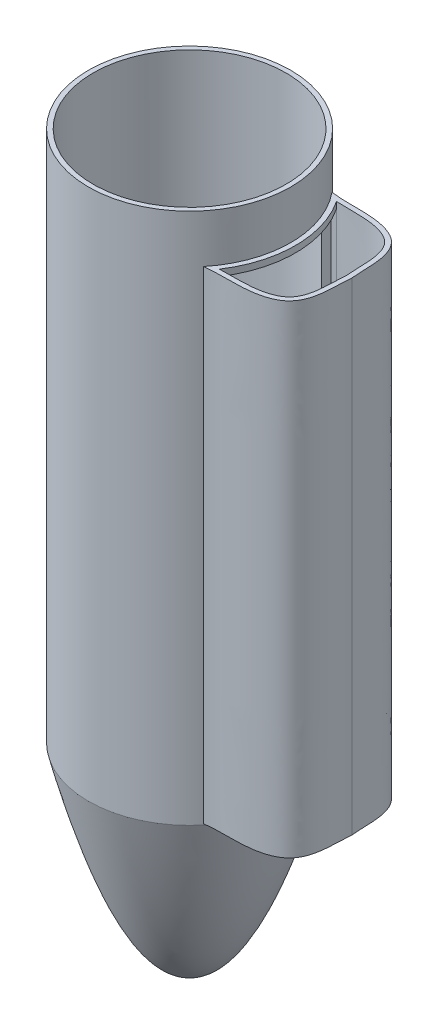
from build123d import *

# Parameters (mm, degrees)
SKETCH_2_R          = 62.908407842
SKETCH_2_R_2        = 60
EXTRUDE_1_DEPTH     = 330
EXTRUDE_START       = 120
EXTRUDE_4_DEPTH     = 300
CUT_EXTRUDE_START   = -30
SKETCH_5_W          = 72
SKETCH_5_H          = 292
CUT_EXTRUDE_2_DEPTH = 18


with BuildPart() as part:
    # Эскиз1 → Повернуть1 (revolve)
    with BuildSketch(Plane.XY, mode=Mode.PRIVATE) as revolve_1_sk:
        with BuildLine():
            Line((60, 120), (62.908407842, 120))
            Line((62.908407842, 120), (62.908407842, 119.264361621))
            add(Edge.make_bspline(
                [(0.146537412, -2.996418994), (0.529065696, -2.977711762), (1.265697509, -2.941722703), (2.538817889, -2.833687069), (3.88739557, -2.604163783), (5.15218658, -2.277601106), (6.357304228, -1.883204814), (7.918990528, -1.273586831), (10.544218169, 0.016383007), (13.874338698, 2.31847492), (18.511365407, 6.56400966), (23.322345732, 12.50099289), (28.167408216, 20.073460146), (32.393246289, 27.908446177), (36.178661594, 35.907467812), (39.632056812, 44.020672418), (43.888107126, 54.948760162), (48.683919334, 68.763712386), (53.85313556, 85.500373253), (57.789846115, 99.528158313), (60.771075111, 110.808987883), (62.195111597, 116.444285272), (62.908407842, 119.264361621)],
                knots=[0, 0, 0, 0, 0.0078125, 0.015625, 0.0234375, 0.03125, 0.0390625, 0.046875, 0.0625, 0.09375, 0.125, 0.1875, 0.25, 0.3125, 0.375, 0.4375, 0.5, 0.625, 0.75, 0.875, 0.9375, 1, 1, 1, 1], degree=3))
            Line((0.146537412, -2.996418994), (0, -2.996418994))
            Line((0, -2.996418994), (0, 0))
            add(Edge.make_bspline(
                [(0, 0), (0.837140692, 0.040939679), (2.534205577, 0.123933244), (5.063102053, 0.789708391), (7.583855293, 1.845492224), (10.096473533, 3.328702549), (12.602579391, 5.224483063), (15.104143012, 7.535149761), (17.602831793, 10.259323693), (20.099848518, 13.397524947), (22.595988042, 16.950030693), (25.091747501, 20.917274068), (27.587425035, 25.299610791), (30.083191974, 30.097350083), (32.579141133, 35.310739635), (35.075317674, 40.93997768), (37.571738593, 46.985220711), (40.068403893, 53.446592521), (42.565306801, 60.324190466), (45.062426245, 67.618094165), (47.559777573, 75.328357954), (50.057220794, 83.455062581), (52.555236186, 91.998124473), (55.051829007, 100.958070563), (57.554866504, 110.332960271), (59.173970738, 116.734224244), (60, 120)],
                knots=[0, 0, 0, 0, 0.017997887, 0.036485602, 0.055915963, 0.076680209, 0.099099857, 0.123430885, 0.149873822, 0.178584979, 0.209686489, 0.243274416, 0.279425012, 0.318199409, 0.359647133, 0.403808717, 0.450717659, 0.5004019, 0.552884949, 0.608186746, 0.66632433, 0.727312365, 0.791163549, 0.857888946, 0.927498251, 1, 1, 1, 1], degree=3))
        make_face()
    revolve(revolve_1_sk.sketch.rotate(Axis((0, 124.77745343, 0), (0, -1, 0)), 180), axis=Axis((0, 124.77745343, 0), (0, -1, 0)))

    # Эскиз2 → Бобышка-Вытянуть1 (add)
    with BuildSketch(Plane(origin=(0, 120, 0), x_dir=(1, 0, 0), z_dir=(0, 1, 0))):
        with Locations(Location((0, 0, 0), (0, 0, 180))):
            Circle(SKETCH_2_R)
        with Locations(Location((0, 0, 0), (0, 0, 180))):
            Circle(SKETCH_2_R_2, mode=Mode.SUBTRACT)
    extrude(amount=EXTRUDE_1_DEPTH)

    # Эскиз4 → Бобышка-Вытянуть4 (add)
    with BuildSketch(Plane(origin=(0, 0, 0), x_dir=(1, 0, 0), z_dir=(0, 1, 0)).offset(EXTRUDE_START)):
        with BuildLine():
            ThreePointArc((48.553761721, -40), (62.908407842, 0), (48.553761721, 40))
            add(Edge.make_bspline(
                [(48.553761721, 40), (60.828119415, 38.177487908), (77.99468202, 41.579723017), (92.580398683, 33.202603918), (101.749664185, 23.269257109), (99.86038151, 8.647717799), (100.908407842, 0)],
                knots=[0, 0, 0, 0, 0.504738554, 0.55693386, 0.625206774, 1, 1, 1, 1], degree=3))
            add(Edge.make_bspline(
                [(48.553761721, -40), (60.828119415, -38.177487908), (77.99468202, -41.579723017), (92.580398683, -33.202603918), (101.749664185, -23.269257109), (99.86038151, -8.647717799), (100.908407842, 0)],
                knots=[0, 0, 0, 0, 0.504738554, 0.55693386, 0.625206774, 1, 1, 1, 1], degree=3))
        make_face()
        with BuildLine():
            ThreePointArc((54.92436897, -36.431194291), (65.908407842, 0), (54.92436897, 36.431194291))
            add(Edge.make_bspline(
                [(54.92436897, 36.431194291), (56.464344859, 36.366295679), (59.538784722, 36.305697115), (65.753577843, 36.286939094), (71.906849007, 36.182190371), (77.76682555, 35.549407709), (81.954931622, 34.713657378), (85.867646729, 33.42650111), (88.925760549, 31.903382882), (90.896102096, 30.434662031), (92.239866564, 29.097201613), (93.405295778, 27.589603522), (94.696199244, 25.401260119), (95.892185228, 22.298529224), (96.765849267, 18.097569675), (97.214309459, 13.590864937), (97.408295848, 8.958092718), (97.517885159, 5.135431949), (97.681904417, 2.156792367), (97.80701686, 0.721850881), (97.888081173, 0)],
                knots=[0.085618197, 0.085618197, 0.085618197, 0.085618197, 0.14246641, 0.199314623, 0.313011049, 0.369859262, 0.426707475, 0.483555688, 0.540403901, 0.568828007, 0.597252114, 0.62567622, 0.654100327, 0.71094854, 0.767796753, 0.824644966, 0.881493179, 0.938341392, 0.966765498, 0.995189604, 0.995189604, 0.995189604, 0.995189604], degree=3))
            add(Edge.make_bspline(
                [(97.888081173, 0), (97.80701686, -0.721850881), (97.681904417, -2.156792367), (97.517885159, -5.135431949), (97.408295848, -8.958092718), (97.214309459, -13.590864937), (96.765849267, -18.097569675), (95.892185228, -22.298529224), (94.696199244, -25.401260119), (93.405295778, -27.589603522), (92.239866564, -29.097201613), (90.896102096, -30.434662031), (88.925760549, -31.903382882), (85.867646729, -33.42650111), (81.954931622, -34.713657378), (77.76682555, -35.549407709), (71.906849007, -36.182190371), (65.753577843, -36.286939094), (59.538784722, -36.305697115), (56.464344859, -36.366295679), (54.92436897, -36.431194291)],
                knots=[0.085618197, 0.085618197, 0.085618197, 0.085618197, 0.114042304, 0.14246641, 0.199314623, 0.256162836, 0.313011049, 0.369859262, 0.426707475, 0.455131581, 0.483555688, 0.511979794, 0.540403901, 0.597252114, 0.654100327, 0.71094854, 0.767796753, 0.881493179, 0.938341392, 0.995189604, 0.995189604, 0.995189604, 0.995189604], degree=3))
        make_face(mode=Mode.SUBTRACT)
    extrude(amount=EXTRUDE_4_DEPTH)

    # Эскиз5 → Вырез-Вытянуть2 (cut)
    with BuildSketch(Plane(origin=(100, 0, 0), x_dir=(0, 0, -1), z_dir=(1, 0, 0)).offset(CUT_EXTRUDE_START)):
        with Locations((0, 270)):
            Rectangle(SKETCH_5_W, SKETCH_5_H)
    extrude(amount=-CUT_EXTRUDE_2_DEPTH, mode=Mode.SUBTRACT)


solid = part.part
